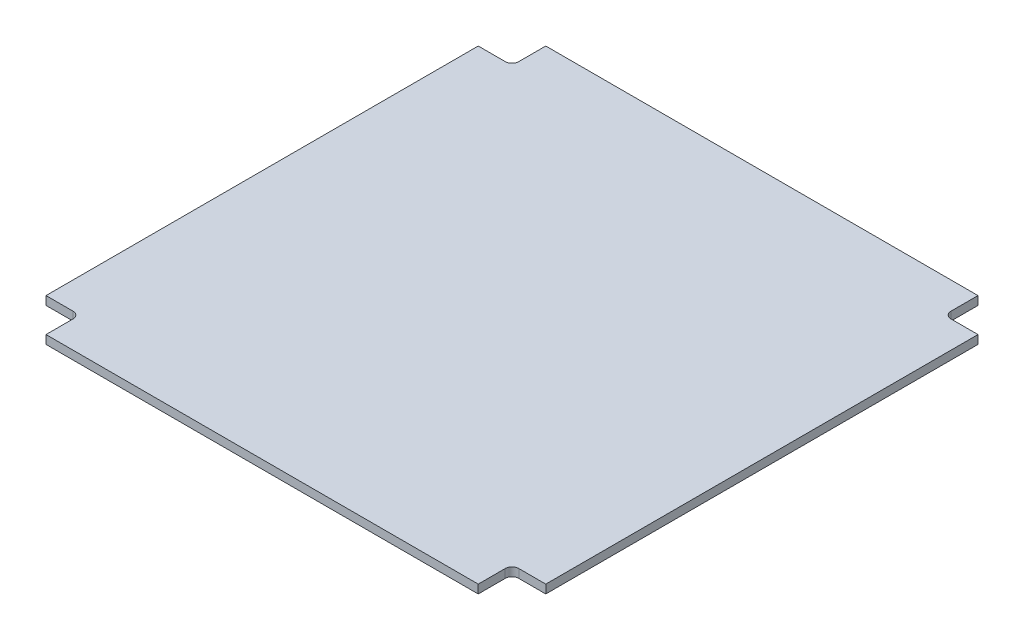
from build123d import *

# Parameters (mm, degrees)
SKETCH1_W                      = 370
SKETCH1_H                      = 370
BOSS_EXTRUDE1_DEPTH            = 6.35
CUT_EXTRUDE2_REACH             = 263.707
CUT_EXTRUDE2_DIRECTION_2_DEPTH = 262.706558


with BuildPart() as part:
    # Sketch1 → Boss-Extrude1 (new body)
    with BuildSketch(Plane(origin=(0, 0, 0), x_dir=(1, 0, 0), z_dir=(0, 1, 0))):
        Rectangle(SKETCH1_W, SKETCH1_H)
    extrude(amount=BOSS_EXTRUDE1_DEPTH)

    # Sketch2 → Cut-Extrude2 (cut, up to next)
    with BuildSketch(Plane(origin=(0, 0, 0), x_dir=(1, 0, 0), z_dir=(0, 1, 0)), mode=Mode.PRIVATE) as cut_extrude2_sk1:
        with BuildLine():
            Line((-185, 185), (-185, 160))
            Line((-185, 160), (-165, 160))
            ThreePointArc((-165, 160), (-161.464466094, 161.464466094), (-160, 165))
            Line((-160, 165), (-160, 185))
            Line((-160, 185), (-185, 185))
        make_face()
    cut_extrude2_tool1 = extrude(cut_extrude2_sk1.sketch, amount=CUT_EXTRUDE2_REACH, mode=Mode.PRIVATE) & part.part
    # Sketch2 → Cut-Extrude2 (cut, up to next)
    with BuildSketch(Plane(origin=(0, 0, 0), x_dir=(1, 0, 0), z_dir=(0, 1, 0)), mode=Mode.PRIVATE) as cut_extrude2_sk2:
        with BuildLine():
            Line((-185, -185), (-160, -185))
            Line((-160, -185), (-160, -165))
            ThreePointArc((-160, -165), (-161.464466094, -161.464466094), (-165, -160))
            Line((-165, -160), (-185, -160))
            Line((-185, -160), (-185, -185))
        make_face()
    cut_extrude2_tool2 = extrude(cut_extrude2_sk2.sketch, amount=CUT_EXTRUDE2_REACH, mode=Mode.PRIVATE) & part.part
    # Sketch2 → Cut-Extrude2 (cut, up to next)
    with BuildSketch(Plane(origin=(0, 0, 0), x_dir=(1, 0, 0), z_dir=(0, 1, 0)), mode=Mode.PRIVATE) as cut_extrude2_sk3:
        with BuildLine():
            Line((185, 185), (160, 185))
            Line((160, 185), (160, 165))
            ThreePointArc((160, 165), (161.464466094, 161.464466094), (165, 160))
            Line((165, 160), (185, 160))
            Line((185, 160), (185, 185))
        make_face()
    cut_extrude2_tool3 = extrude(cut_extrude2_sk3.sketch, amount=CUT_EXTRUDE2_REACH, mode=Mode.PRIVATE) & part.part
    # Sketch2 → Cut-Extrude2 (cut, up to next)
    with BuildSketch(Plane(origin=(0, 0, 0), x_dir=(1, 0, 0), z_dir=(0, 1, 0)), mode=Mode.PRIVATE) as cut_extrude2_sk4:
        with BuildLine():
            Line((185, -185), (185, -160))
            Line((185, -160), (165, -160))
            ThreePointArc((165, -160), (161.464466094, -161.464466094), (160, -165))
            Line((160, -165), (160, -185))
            Line((160, -185), (185, -185))
        make_face()
    cut_extrude2_tool4 = extrude(cut_extrude2_sk4.sketch, amount=CUT_EXTRUDE2_REACH, mode=Mode.PRIVATE) & part.part
    add(cut_extrude2_tool1.solids().sort_by_distance((-172.59856, 0, -172.59856))[0], mode=Mode.SUBTRACT)
    add(cut_extrude2_tool2.solids().sort_by_distance((-172.59856, 0, 172.59856))[0], mode=Mode.SUBTRACT)
    add(cut_extrude2_tool3.solids().sort_by_distance((172.59856, 0, -172.59856))[0], mode=Mode.SUBTRACT)
    add(cut_extrude2_tool4.solids().sort_by_distance((172.59856, 0, 172.59856))[0], mode=Mode.SUBTRACT)

    # Sketch2 → Cut-Extrude2 direction 2 (cut)
    with BuildSketch(Plane(origin=(0, 0, 0), x_dir=(1, 0, 0), z_dir=(0, 1, 0))):
        with BuildLine():
            Line((-185, 185), (-185, 160))
            Line((-185, 160), (-165, 160))
            ThreePointArc((-165, 160), (-161.464466094, 161.464466094), (-160, 165))
            Line((-160, 165), (-160, 185))
            Line((-160, 185), (-185, 185))
        make_face()
        with BuildLine():
            Line((-185, -185), (-160, -185))
            Line((-160, -185), (-160, -165))
            ThreePointArc((-160, -165), (-161.464466094, -161.464466094), (-165, -160))
            Line((-165, -160), (-185, -160))
            Line((-185, -160), (-185, -185))
        make_face()
        with BuildLine():
            Line((185, 185), (160, 185))
            Line((160, 185), (160, 165))
            ThreePointArc((160, 165), (161.464466094, 161.464466094), (165, 160))
            Line((165, 160), (185, 160))
            Line((185, 160), (185, 185))
        make_face()
        with BuildLine():
            Line((185, -185), (185, -160))
            Line((185, -160), (165, -160))
            ThreePointArc((165, -160), (161.464466094, -161.464466094), (160, -165))
            Line((160, -165), (160, -185))
            Line((160, -185), (185, -185))
        make_face()
    extrude(amount=-CUT_EXTRUDE2_DIRECTION_2_DEPTH, mode=Mode.SUBTRACT)


solid = part.part
